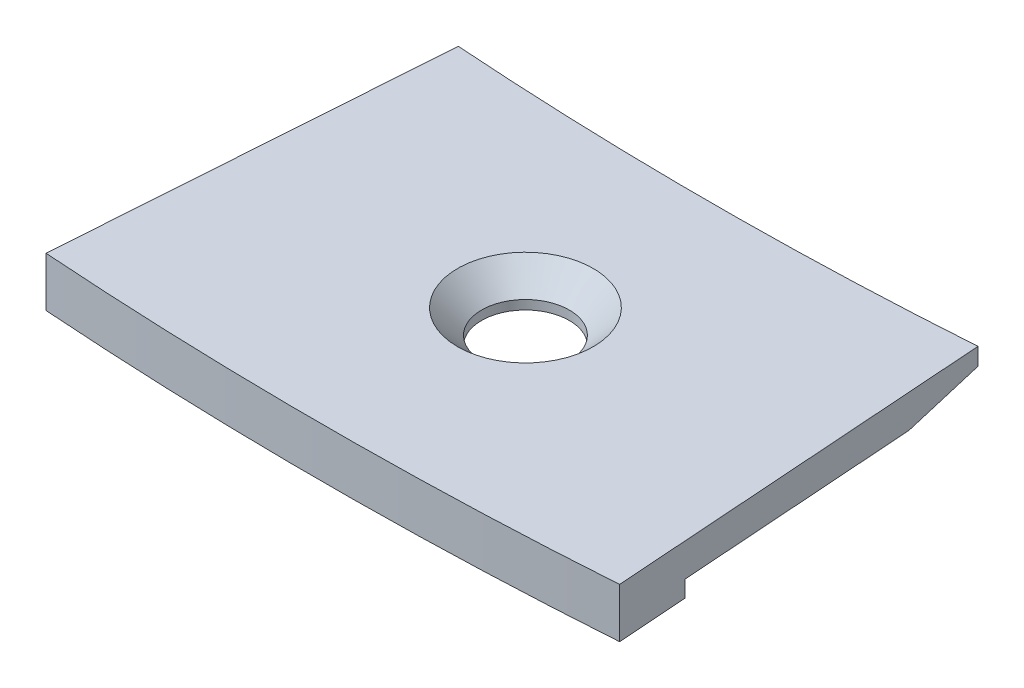
from build123d import *

# Parameters (mm, degrees)
SKETCH2_R           = 2.65
BOSS_EXTRUDE1_DEPTH = 2
BOSS_EXTRUDE2_DEPTH = 2
CHAMFER1_SIZE       = 4.5
CHAMFER1_SIZE2      = 0.956504528
BOSS_EXTRUDE3_START = 1
BOSS_EXTRUDE3_DEPTH = 1


with BuildPart() as part:
    # Sketch2 → Boss-Extrude1 (new body)
    with BuildSketch(Plane(origin=(0, 0, 0), x_dir=(1, 0, 0), z_dir=(0, 1, 0))):
        with BuildLine():
            Line((-15.984695958, -228.591802117), (-17.334483725, -247.89466649))
            ThreePointArc((-17.334483725, -247.89466649), (0, -248.5), (17.334483725, -247.89466649))
            Line((17.334483725, -247.89466649), (15.984695958, -228.591802117))
            ThreePointArc((15.984695958, -228.591802117), (0, -229.15), (-15.984695958, -228.591802117))
        make_face()
        with Locations(Location((0, -236.25, 0), (0, 0, 270))):
            Circle(SKETCH2_R, mode=Mode.SUBTRACT)
    extrude(amount=BOSS_EXTRUDE1_DEPTH)

    # Sketch3 → Boss-Extrude2 (add)
    with BuildSketch(Plane(origin=(0, 0, 0), x_dir=(1, 0, 0), z_dir=(0, 1, 0))):
        with BuildLine():
            Line((-15.705670063, -224.601545916), (-15.984695958, -228.591802117))
            ThreePointArc((-15.984695958, -228.591802117), (0, -229.15), (15.984695958, -228.591802117))
            Line((15.984695958, -228.591802117), (15.705670063, -224.601545916))
            ThreePointArc((15.705670063, -224.601545916), (0, -225.15), (-15.705670063, -224.601545916))
        make_face()
    extrude(amount=BOSS_EXTRUDE2_DEPTH)

    # Chamfer1
    chamfer1_edges = [part.edges().sort_by_distance(p)[0] for p in [
        (0, 0, 225.15),
    ]]
    chamfer1_side = [part.faces().sort_by_distance(p)[0] for p in [
        (16.100023839, 0, 236.277479174),
    ]]
    chamfer(chamfer1_edges, length=CHAMFER1_SIZE, length2=CHAMFER1_SIZE2, reference=chamfer1_side[0])

    # Sketch4 → Boss-Extrude3 (add)
    with BuildSketch(Plane.XZ.offset(BOSS_EXTRUDE3_START)):
        with BuildLine():
            Line((-17.334483725, 247.89466649), (-17.038018712, 243.655019276))
            ThreePointArc((-17.038018712, 243.655019276), (0, 244.25), (17.038018712, 243.655019276))
            Line((17.038018712, 243.655019276), (17.334483725, 247.89466649))
            ThreePointArc((17.334483725, 247.89466649), (0, 248.5), (-17.334483725, 247.89466649))
        make_face()
    extrude(amount=-BOSS_EXTRUDE3_DEPTH)

    # Sketch20 → CSK for M3.5 Flat Head Machine Screw2 (revolve, cut)
    with BuildSketch(Plane(origin=(0, 2, 236.25), x_dir=(0, 0, 1), z_dir=(1, 0, 0))):
        Polygon((0, 0), (0, 3), (1.85, 3), (1.85, 2.25), (4.1, 0), align=None)
    revolve(axis=Axis((0, 8.35, 236.25), (0, -1, 0)), mode=Mode.SUBTRACT)


solid = part.part
